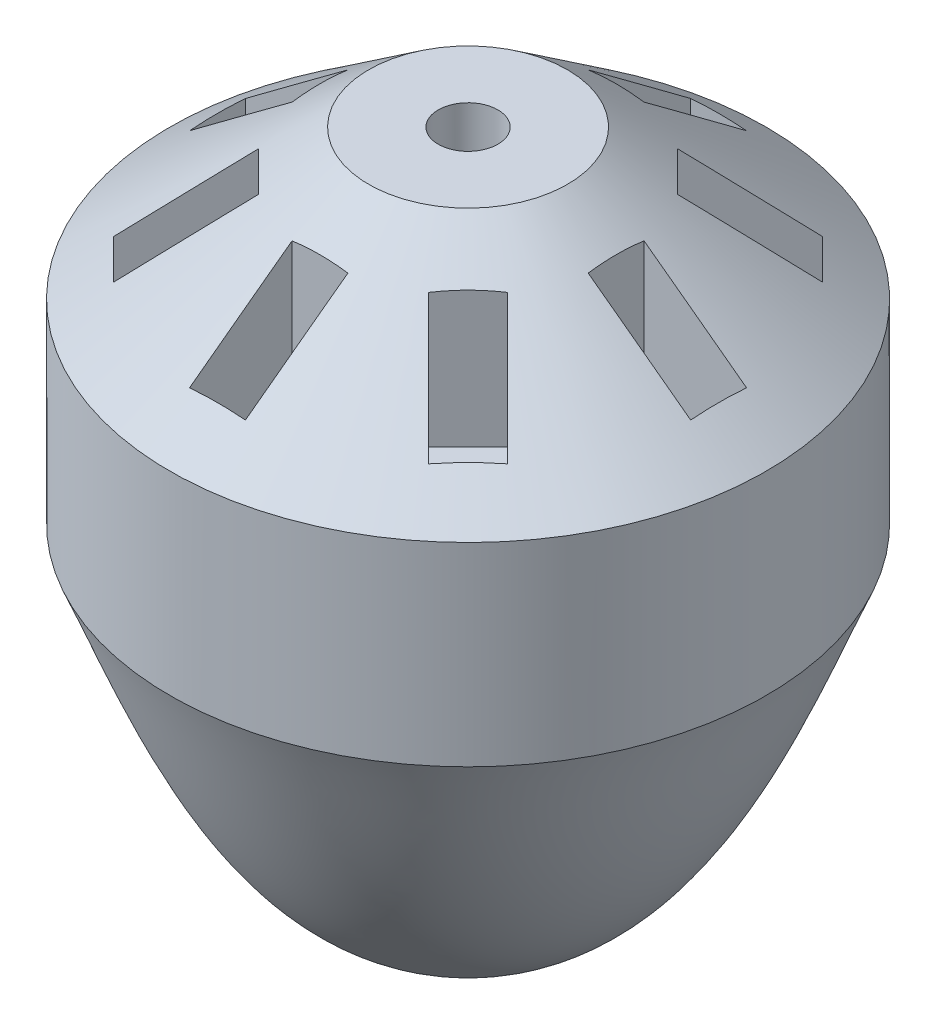
from build123d import *

# Parameters (mm, degrees)
CUT_EXTRUDE_1_DEPTH      = 10
CUT_EXTRUDE_1_DEPTH_BACK = 1
SKETCH_3_R               = 1.5
CUT_EXTRUDE_START        = -1
SKETCH_4_W               = 2.811133726
SKETCH_4_H               = 5.156078578
CUT_EXTRUDE_2_DEPTH      = 36.217034404
PATTERN_CIRCULAR_1_COUNT = 8


with BuildPart() as part:
    # 草图1 → 旋转3 (revolve)
    with BuildSketch(Plane.XY, mode=Mode.PRIVATE) as revolve_3_sk:
        with BuildLine():
            Line((-15, 0.182551999), (-5, 7.680235811))
            Line((-5, 7.680235811), (0, 7.680235811))
            Line((0, 7.680235811), (0, -9.593702865))
            Line((0, -9.593702865), (0, -26.791420925))
            add(Edge.make_bspline(
                [(0, -26.791420925), (-8.890332256, -27.786972395), (-12.567592708, -15.34792859), (-15, -9.593702865)],
                knots=[0, 0, 0, 0, 1, 1, 1, 1], degree=3))
            Line((-15, -9.593702865), (-15, -6.069622936))
            Line((-15, -6.069622936), (-15, -3.569622936))
            Line((-15, -3.569622936), (-15, 0.182551999))
        make_face()
    revolve(revolve_3_sk.sketch.rotate(Axis((0, -9.593702865, 0), (0, 1, 0)), 270), axis=Axis((0, -9.593702865, 0), (0, 1, 0)))

    # 草图3 → 切除-拉伸1 (cut, two sides: drawn at the far end of the back side and taken through both)
    with BuildSketch(Plane(origin=(0, 0, 0), x_dir=(1, 0, 0), z_dir=(0, 1, 0)).offset(-CUT_EXTRUDE_1_DEPTH_BACK)):
        with Locations(Location((0, 0, 0), (0, 0, 90))):
            Circle(SKETCH_3_R)
    extrude(amount=CUT_EXTRUDE_1_DEPTH + CUT_EXTRUDE_1_DEPTH_BACK, mode=Mode.SUBTRACT)

    # 草图4 → 切除-拉伸2 (cut)
    with BuildSketch(Plane(origin=(0, 0, 0), x_dir=(1, 0, 0), z_dir=(0, 1, 0)).offset(CUT_EXTRUDE_START)):
        with Locations((0, 10.028828945)):
            Rectangle(SKETCH_4_W, SKETCH_4_H)
    cut_extrude_2 = extrude(amount=CUT_EXTRUDE_2_DEPTH, mode=Mode.SUBTRACT)

    # 阵列(圆周)1: 切除-拉伸2 ×8 about axis
    pattern_circular_1_axis = Axis((0, 0, 0), (0, 1, 0))
    for i in range(1, PATTERN_CIRCULAR_1_COUNT):
        add(cut_extrude_2.rotate(pattern_circular_1_axis, i * 360 / PATTERN_CIRCULAR_1_COUNT), mode=Mode.SUBTRACT)


solid = part.part
